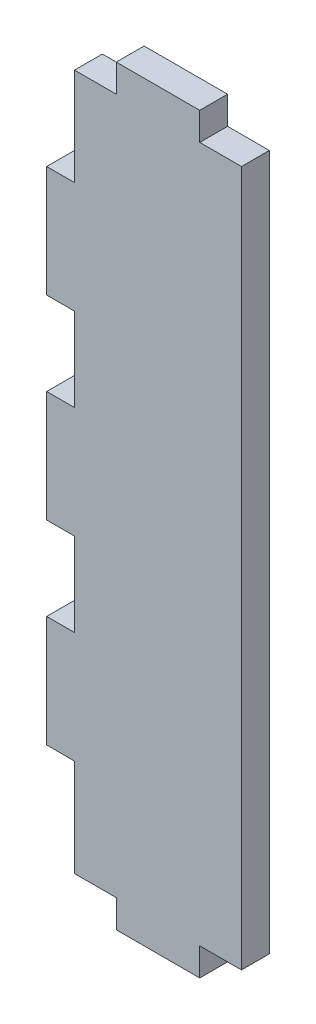
from build123d import *

# Parameters (mm, degrees)
BOSS_EXTRUDE1_DEPTH = 5


with BuildPart() as part:
    # Sketch1 → Boss-Extrude1 (new body)
    with BuildSketch(Plane.XY):
        Polygon((25, 127.5), (20, 127.5), (20, 147.5), (25, 147.5), (25, 165), (32.5, 165), (32.5, 170), (47.5, 170), (47.5, 165), (55, 165), (55, 40), (47.5, 40), (47.5, 35), (32.5, 35), (32.5, 40), (25, 40), (25, 57.5), (20, 57.5), (20, 77.5), (25, 77.5), (25, 92.5), (20, 92.5), (20, 112.5), (25, 112.5), align=None)
    extrude(amount=-BOSS_EXTRUDE1_DEPTH)


solid = part.part
